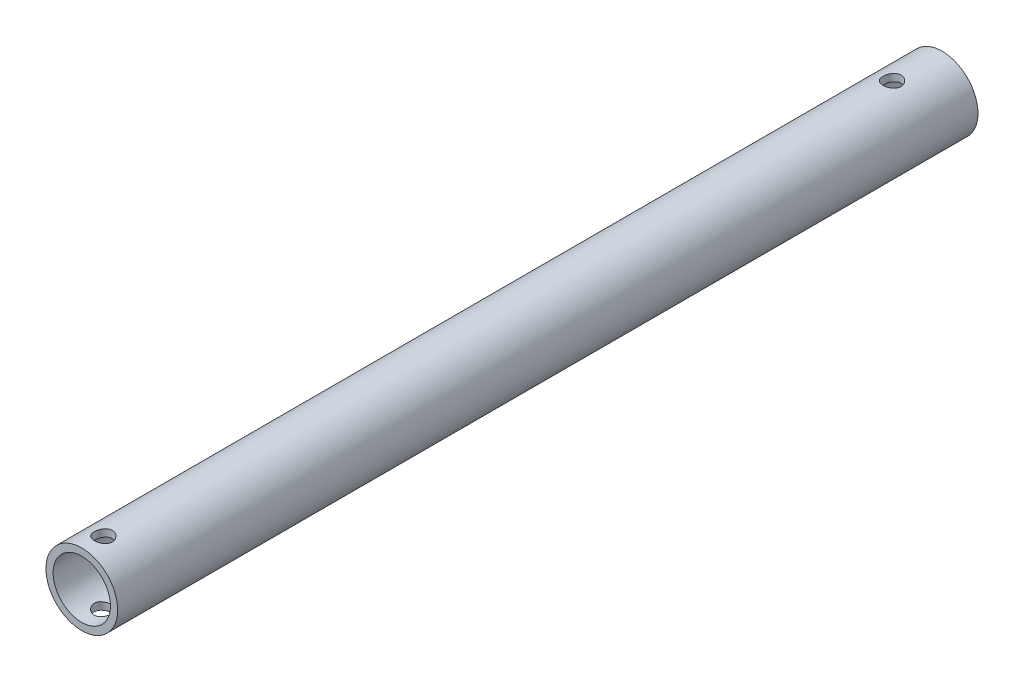
from build123d import *

# Parameters (mm, degrees)
SKETCH3_R               = 15.875
SKETCH3_R_2             = 12.7
BOSS_EXTRUDE1_DEPTH     = 457.2
SKETCH4_R               = 24.687530181
CUT_EXTRUDE1_DEPTH      = 533.4
CUT_EXTRUDE2_DEPTH      = 458.750883396
CUT_EXTRUDE2_DEPTH_BACK = 458.750883396
SKETCH5_R               = 3.96875


with BuildPart() as part:
    # Sketch3 → Boss-Extrude1 (new, symmetric)
    with BuildSketch(Plane.XY):
        Circle(SKETCH3_R)
        Circle(SKETCH3_R_2, mode=Mode.SUBTRACT)
    extrude(amount=BOSS_EXTRUDE1_DEPTH, both=True)

    # Sketch4 → Cut-Extrude1 (cut)
    with BuildSketch(Plane.XY.offset(457.2)):
        Circle(SKETCH4_R)
    extrude(amount=-CUT_EXTRUDE1_DEPTH, mode=Mode.SUBTRACT)

    # Sketch5 → Cut-Extrude2 (cut, two sides: drawn at the far end of the back side and taken through both)
    with BuildSketch(Plane(origin=(0, 0, 0), x_dir=(1, 0, 0), z_dir=(0, 1, 0)).offset(-CUT_EXTRUDE2_DEPTH_BACK)):
        with Locations(Location((0, 85.725, 0), (0, 0, 270))):
            Circle(SKETCH5_R)
        with Locations(Location((0, 434.975, 0), (0, 0, 270))):
            Circle(SKETCH5_R)
    extrude(amount=CUT_EXTRUDE2_DEPTH + CUT_EXTRUDE2_DEPTH_BACK, mode=Mode.SUBTRACT)


solid = part.part
